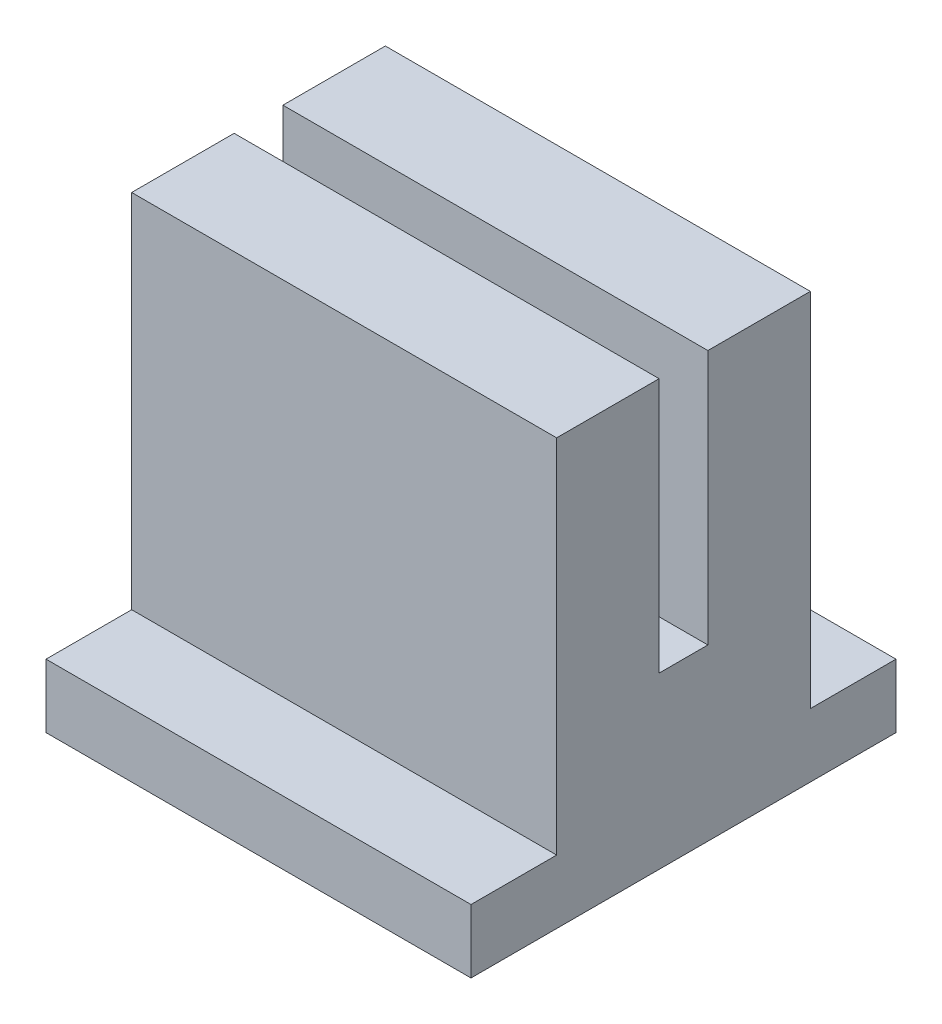
from build123d import *

# Parameters (mm, degrees)
BOSS_EXTRUDE5_DEPTH = 50


with BuildPart() as part:
    # Sketch7 → Boss-Extrude5 (new body)
    with BuildSketch(Plane(origin=(0, 0, 0), x_dir=(0, 0, -1), z_dir=(1, 0, 0))):
        Polygon((0, 0), (0, -7.487925166), (50, -7.487925166), (50, 0), (39.923677648, 0), (39.923677648, 42.512074834), (27.868347365, 42.512074834), (27.868347365, 12.512074834), (22.131652635, 12.512074834), (22.131652635, 42.512074834), (10.076322352, 42.512074834), (10.076322352, 0), align=None)
    extrude(amount=BOSS_EXTRUDE5_DEPTH)


solid = part.part
